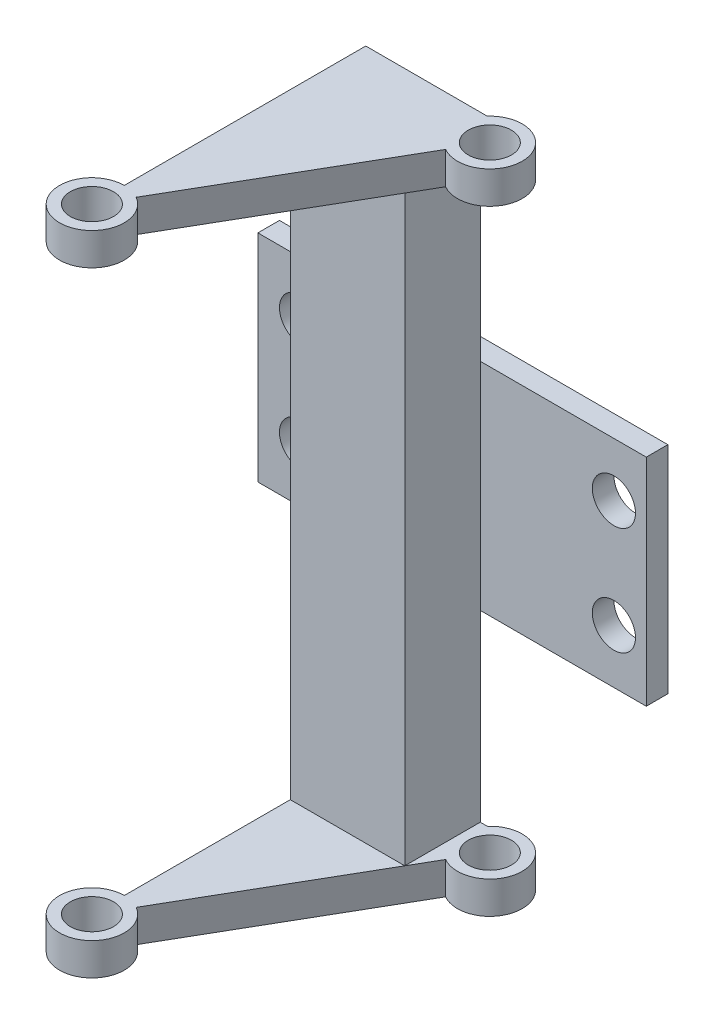
from build123d import *

# Parameters (mm, degrees)
SKETCH_1_W          = 30
SKETCH_1_H          = 20
SKETCH_1_R          = 2
EXTRUDE_2_DEPTH     = 1
SKETCH_3_W          = 2
SKETCH_3_H          = 20
EXTRUDE_4_DEPTH     = 6
SKETCH_4_R          = 2
CUT_EXTRUDE_1_DEPTH = 6
EXTRUDE_START       = -17
SKETCH_8_W          = 10.614335182
SKETCH_8_H          = 6.998118079
EXTRUDE_6_DEPTH     = 54
EXTRUDE_START_2     = 17
SKETCH_2_R          = 2
EXTRUDE_7_DEPTH     = 3
EXTRUDE_START_3     = -40
SKETCH_2_2_R        = 2
EXTRUDE_8_DEPTH     = 3


with BuildPart() as part:
    # 草图1 → 凸台-拉伸2 (new, symmetric)
    with BuildSketch(Plane.XY):
        with Locations((15, 10)):
            Rectangle(SKETCH_1_W, SKETCH_1_H)
        with Locations((4, 15)):
            Circle(SKETCH_1_R, mode=Mode.SUBTRACT)
        with Locations((4, 5)):
            Circle(SKETCH_1_R, mode=Mode.SUBTRACT)
    extrude(amount=EXTRUDE_2_DEPTH, both=True)

    # 草图3 → 凸台-拉伸4 (add)
    with BuildSketch(Plane(origin=(30, 0, 0), x_dir=(0, 0, -1), z_dir=(1, 0, 0))):
        with Locations((0, 10)):
            Rectangle(SKETCH_3_W, SKETCH_3_H)
    extrude(amount=EXTRUDE_4_DEPTH)

    # 草图4 → 切除-拉伸1 (cut)
    with BuildSketch(Plane.XY.offset(1)):
        with Locations((33, 15)):
            Circle(SKETCH_4_R)
        with Locations((33, 5)):
            Circle(SKETCH_4_R)
    extrude(amount=-CUT_EXTRUDE_1_DEPTH, mode=Mode.SUBTRACT)

    # 草图8 → 凸台-拉伸6 (add)
    with BuildSketch(Plane(origin=(0, 0, 0), x_dir=(1, 0, 0), z_dir=(0, 1, 0)).offset(EXTRUDE_START)):
        with Locations((15.307167591, -4.49905904)):
            Rectangle(SKETCH_8_W, SKETCH_8_H)
    extrude(amount=EXTRUDE_6_DEPTH)

    # 草图2 → 凸台-拉伸7 (add)
    with BuildSketch(Plane.XZ.offset(EXTRUDE_START_2)):
        with BuildLine():
            Line((10, 1), (21.263932023, 1))
            ThreePointArc((21.263932023, 1), (26.462284118, 2.525792445), (22, 5.598076211))
            Line((22, 5.598076211), (11.5, 23.784609691))
            ThreePointArc((11.5, 23.784609691), (9.223542865, 29.280463381), (10, 23.382685902))
            Line((10, 23.382685902), (10, 3))
            Line((10, 3), (10, 1))
        make_face()
        with Locations(Location((23.5, 3, 0), (0, 0, 270))):
            Circle(SKETCH_2_R, mode=Mode.SUBTRACT)
        with Locations(Location((10, 26.382685902, 0), (0, 0, 270))):
            Circle(SKETCH_2_R, mode=Mode.SUBTRACT)
    extrude(amount=EXTRUDE_7_DEPTH)

    # 草图2<2> → 凸台-拉伸8 (add)
    with BuildSketch(Plane.XZ.offset(EXTRUDE_START_3)):
        with BuildLine():
            Line((10, 1), (21.263932023, 1))
            ThreePointArc((21.263932023, 1), (26.462284118, 2.525792445), (22, 5.598076211))
            Line((22, 5.598076211), (11.5, 23.784609691))
            ThreePointArc((11.5, 23.784609691), (9.223542865, 29.280463381), (10, 23.382685902))
            Line((10, 23.382685902), (10, 3))
            Line((10, 3), (10, 1))
        make_face()
        with Locations(Location((23.5, 3, 0), (0, 0, 270))):
            Circle(SKETCH_2_2_R, mode=Mode.SUBTRACT)
        with Locations(Location((10, 26.382685902, 0), (0, 0, 270))):
            Circle(SKETCH_2_2_R, mode=Mode.SUBTRACT)
    extrude(amount=EXTRUDE_8_DEPTH)


solid = part.part
